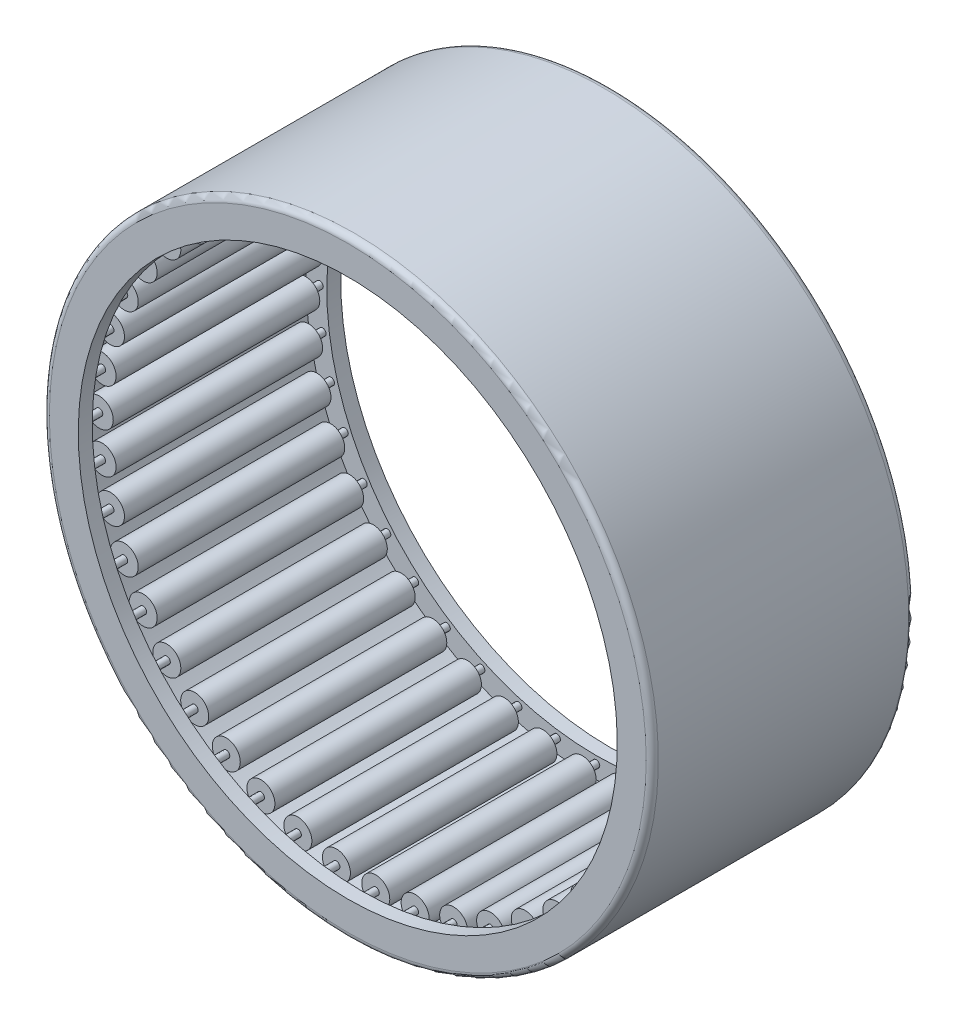
from build123d import *

# Parameters (mm, degrees)
SKETCH2_W           = 19.666666666
SKETCH2_H           = 1
SKETCH3_W           = 22.333333334
SKETCH3_H           = 0.333333334
CIRPATTERN1_COUNT   = 44
CIRPATTERN1_ANGLE   = 351.818181818
CIRPATTERN1_2_COUNT = 44
CIRPATTERN1_2_ANGLE = 351.818181818
FILLET1_R           = 0.58


with BuildPart() as part:
    # Sketch7 → Revolve1 (revolve)
    with BuildSketch(Plane(origin=(0, 0, 0), x_dir=(0, 0, -1), z_dir=(1, 0, 0)), mode=Mode.PRIVATE) as revolve1_sk:
        Polygon((-12.5, 29), (-12.5, 25.666666667), (-11.166666667, 25.666666667), (-11.166666667, 27.666666667), (11.166666667, 27.666666667), (11.166666667, 25.666666667), (12.5, 25.666666667), (12.5, 29), align=None)
    revolve(revolve1_sk.sketch.rotate(Axis((0, 0, 12.5), (0, 0, -1)), 180), axis=Axis((0, 0, 12.5), (0, 0, -1)))

    # Fillet1
    fillet1_edges = [part.edges().sort_by_distance(p)[0] for p in [
        (0, 29, -12.5),
        (0, 29, 12.5),
    ]]
    fillet(fillet1_edges, radius=FILLET1_R)


with BuildPart() as body_2:
    # Sketch2 → Revolve2 (revolve)
    with BuildSketch(Plane(origin=(0, 0, 0), x_dir=(0, 0, -1), z_dir=(1, 0, 0)), mode=Mode.PRIVATE) as revolve2_sk:
        with Locations((0, 27.166666667)):
            Rectangle(SKETCH2_W, SKETCH2_H)
    revolve(revolve2_sk.sketch.rotate(Axis((0, 26.333333333, 9.833333333), (0, 0, -1)), 180), axis=Axis((0, 26.333333333, 9.833333333), (0, 0, -1)))

    # CirPattern1: body 2 ×44 about axis
    cirpattern1_axis = Axis((0, 0, 12.5), (0, 0, -1))


with BuildPart() as body_3:
    # Sketch3 → Revolve3 (revolve)
    with BuildSketch(Plane(origin=(0, 0, 0), x_dir=(0, 0, -1), z_dir=(1, 0, 0)), mode=Mode.PRIVATE) as revolve3_sk:
        with Locations((0, 26.5)):
            Rectangle(SKETCH3_W, SKETCH3_H)
    revolve(revolve3_sk.sketch.rotate(Axis((0, 26.333333333, 11.166666667), (0, 0, -1)), 90), axis=Axis((0, 26.333333333, 11.166666667), (0, 0, -1)))

    # CirPattern1 2: body 3 ×44 about axis
    cirpattern1_2_axis = Axis((0, 0, 12.5), (0, 0, -1))


with BuildPart() as body_2_1:
    add(body_2.part)
    for i in range(1, CIRPATTERN1_COUNT):
        add(body_2.part.rotate(cirpattern1_axis, i * CIRPATTERN1_ANGLE / (CIRPATTERN1_COUNT - 1)))


with BuildPart() as body_3_1:
    add(body_3.part)
    for i in range(1, CIRPATTERN1_2_COUNT):
        add(body_3.part.rotate(cirpattern1_2_axis, i * CIRPATTERN1_2_ANGLE / (CIRPATTERN1_2_COUNT - 1)))


solid = Compound([part.part, body_2_1.part, body_3_1.part])
